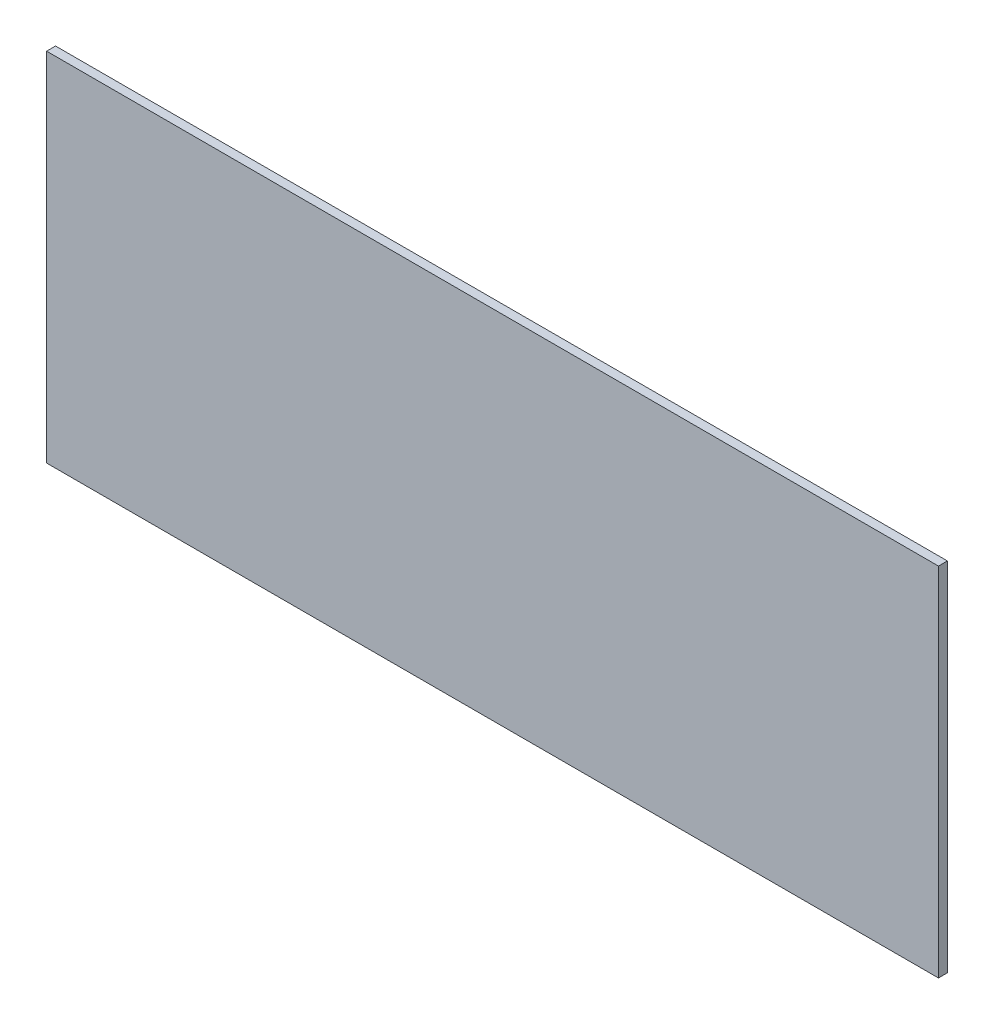
from build123d import *

# Parameters (mm, degrees)
SKETCH1_W           = 254
SKETCH1_H           = 101.6
BOSS_EXTRUDE1_DEPTH = 2.54


with BuildPart() as part:
    # Sketch1 → Boss-Extrude1 (new body)
    with BuildSketch(Plane.XY):
        with Locations((127, 50.8)):
            Rectangle(SKETCH1_W, SKETCH1_H)
    extrude(amount=BOSS_EXTRUDE1_DEPTH)


solid = part.part
